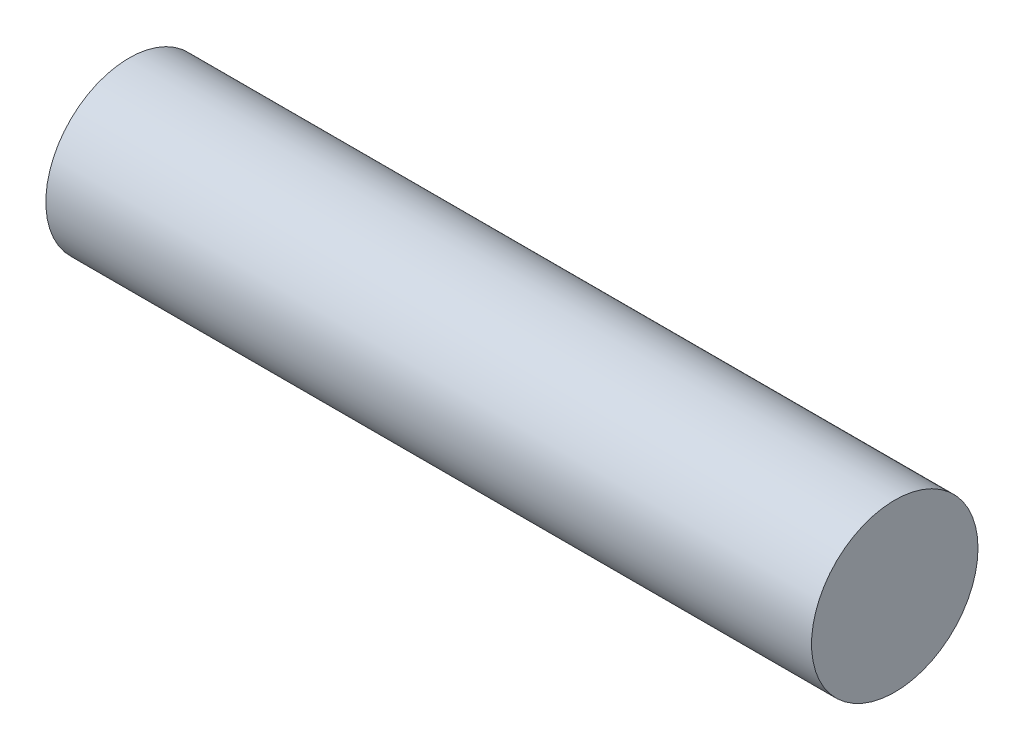
from build123d import *

# Parameters (mm, degrees)
SKETCH1_R           = 15.875
BOSS_EXTRUDE1_DEPTH = 146.05


with BuildPart() as part:
    # Sketch1 → Boss-Extrude1 (new body)
    with BuildSketch(Plane(origin=(0, 0, 0), x_dir=(0, 0, -1), z_dir=(1, 0, 0))):
        Circle(SKETCH1_R)
    extrude(amount=BOSS_EXTRUDE1_DEPTH)


solid = part.part
